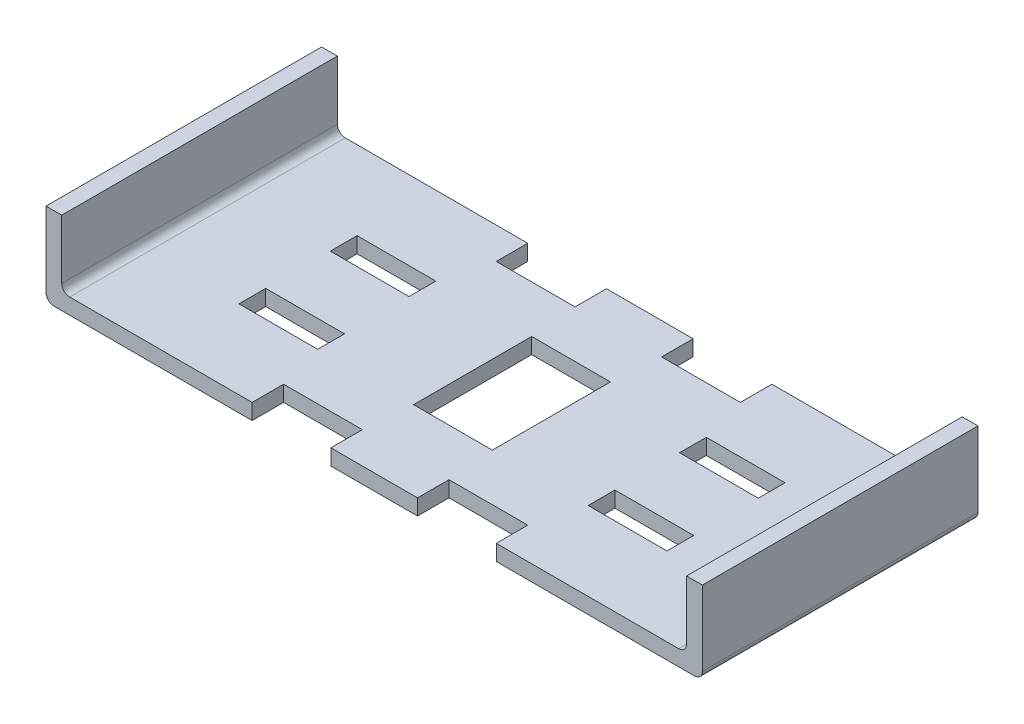
from build123d import *

# Parameters (mm, degrees)
SKETCH1_W           = 166.7
SKETCH1_H           = 70
BOSS_EXTRUDE1_DEPTH = 4
SKETCH2_W           = 4
SKETCH2_H           = 70
BOSS_EXTRUDE2_DEPTH = 17
SKETCH3_W           = 20
SKETCH3_H           = 6.8
CUT_EXTRUDE1_DEPTH  = 92.984903653
SKETCH4_W           = 20
SKETCH4_H           = 30
CUT_EXTRUDE2_DEPTH  = 93.807448516
FILLET1_R           = 2
SKETCH5_W           = 20
SKETCH5_H           = 8
CUT_EXTRUDE3_DEPTH  = 93.807448516


with BuildPart() as part:
    # Sketch1 → Boss-Extrude1 (new body)
    with BuildSketch(Plane(origin=(0, 0, 0), x_dir=(1, 0, 0), z_dir=(0, 1, 0))):
        Rectangle(SKETCH1_W, SKETCH1_H)
    extrude(amount=BOSS_EXTRUDE1_DEPTH)

    # Sketch2 → Boss-Extrude2 (add)
    with BuildSketch(Plane(origin=(0, 4, 0), x_dir=(1, 0, 0), z_dir=(0, 1, 0))):
        with Locations((81.35, 0)):
            Rectangle(SKETCH2_W, SKETCH2_H)
        with Locations((-81.35, 0)):
            Rectangle(SKETCH2_W, SKETCH2_H)
    extrude(amount=BOSS_EXTRUDE2_DEPTH)

    # Sketch3 → Cut-Extrude1 (cut, through all)
    with BuildSketch(Plane(origin=(0, 4, 0), x_dir=(1, 0, 0), z_dir=(0, 1, 0))):
        with Locations((-44.35, 11.6)):
            Rectangle(SKETCH3_W, SKETCH3_H)
        with Locations((-44.35, -11.6)):
            Rectangle(SKETCH3_W, SKETCH3_H)
        with Locations((44.35, -11.6)):
            Rectangle(SKETCH3_W, SKETCH3_H)
        with Locations((44.35, 11.6)):
            Rectangle(SKETCH3_W, SKETCH3_H)
    extrude(amount=-CUT_EXTRUDE1_DEPTH, mode=Mode.SUBTRACT)

    # Sketch4 → Cut-Extrude2 (cut, through all)
    with BuildSketch(Plane.XZ):
        Rectangle(SKETCH4_W, SKETCH4_H)
    extrude(amount=-CUT_EXTRUDE2_DEPTH, mode=Mode.SUBTRACT)

    # Fillet1
    fillet1_edges = [part.edges().sort_by_distance(p)[0] for p in [
        (79.35, 4, 0),
        (-79.35, 4, 0),
        (-83.35, 0, 0),
        (83.35, 0, 0),
    ]]
    fillet(fillet1_edges, radius=FILLET1_R)

    # Sketch5 → Cut-Extrude3 (cut, through all)
    with BuildSketch(Plane.XZ):
        with Locations((-21, -31)):
            Rectangle(SKETCH5_W, SKETCH5_H)
        with Locations((-21, 31)):
            Rectangle(SKETCH5_W, SKETCH5_H)
        with Locations((21, 31)):
            Rectangle(SKETCH5_W, SKETCH5_H)
        with Locations((21, -31)):
            Rectangle(SKETCH5_W, SKETCH5_H)
    extrude(amount=-CUT_EXTRUDE3_DEPTH, mode=Mode.SUBTRACT)


solid = part.part
